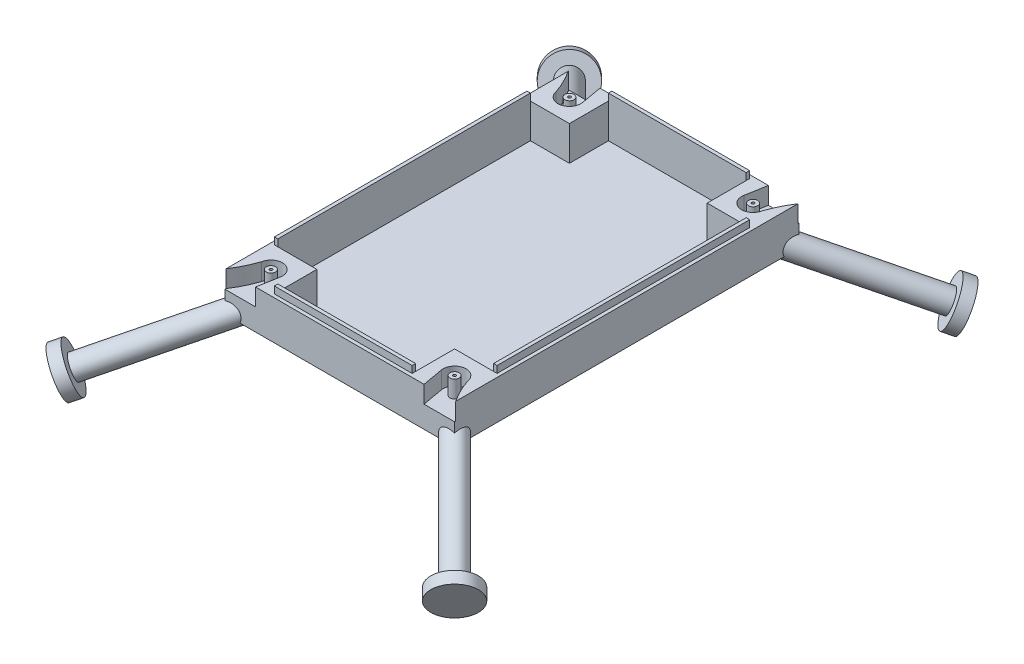
from build123d import *

# Parameters (mm, degrees)
CROQUIS1_W              = 100
CROQUIS1_H              = 150
SALIENTE_EXTRUIR1_DEPTH = 2
CROQUIS5_W              = 100
CROQUIS5_H              = 150
CROQUIS5_W_2            = 94
CROQUIS5_H_2            = 144
SALIENTE_EXTRUIR3_DEPTH = 15
CROQUIS6_W              = 20
CROQUIS6_H              = 20
SALIENTE_EXTRUIR4_DEPTH = 17
CROQUIS4_R              = 2
CORTAR_EXTRUIR2_DEPTH   = 92.378334412
SALIENTE_EXTRUIR5_DEPTH = 7.5
CROQUIS8_W              = 127.938872722
CROQUIS8_H              = 211.588515632
CROQUIS8_W_2            = 100
CROQUIS8_H_2            = 150
CORTAR_EXTRUIR3_DEPTH   = 115.867495711
CORTAR_EXTRUIR4_DEPTH   = 7.5
CROQUIS10_W             = 60
CROQUIS10_H             = 1.5
CROQUIS10_W_2           = 1.5
CROQUIS10_H_2           = 110
SALIENTE_EXTRUIR6_DEPTH = 3
CROQUIS12_R             = 0.6
CORTAR_EXTRUIR5_DEPTH   = 2
CORTAR_EXTRUIR7_DEPTH   = 157.655827733


with BuildPart() as part:
    # Croquis1 → Saliente-Extruir1 (new body)
    with BuildSketch(Plane(origin=(0, 0, 0), x_dir=(1, 0, 0), z_dir=(0, 1, 0))):
        Rectangle(CROQUIS1_W, CROQUIS1_H)
    extrude(amount=SALIENTE_EXTRUIR1_DEPTH)

    # Croquis5 → Saliente-Extruir3 (add)
    with BuildSketch(Plane(origin=(0, 2, 0), x_dir=(1, 0, 0), z_dir=(0, 1, 0))):
        Rectangle(CROQUIS5_W, CROQUIS5_H)
        Rectangle(CROQUIS5_W_2, CROQUIS5_H_2, mode=Mode.SUBTRACT)
    extrude(amount=SALIENTE_EXTRUIR3_DEPTH)

    # Croquis6 → Saliente-Extruir4 (add)
    with BuildSketch(Plane.XZ):
        with Locations((-40, 65)):
            Rectangle(CROQUIS6_W, CROQUIS6_H)
        with Locations((-40, -65)):
            Rectangle(CROQUIS6_W, CROQUIS6_H)
        with Locations((40, -65)):
            Rectangle(CROQUIS6_W, CROQUIS6_H)
        with Locations((40, 65)):
            Rectangle(CROQUIS6_W, CROQUIS6_H)
    extrude(amount=-SALIENTE_EXTRUIR4_DEPTH)

    # Croquis4 → Cortar-Extruir2 (cut, through all)
    # profile 1 of 4: a face of its own
    with BuildSketch(Plane(origin=(0, 2, 0), x_dir=(1, 0, 0), z_dir=(0, 1, 0))):
        with BuildLine():
            Line((-44.924038765, 64.131759112), (-46.660520542, 73.979836642))
            ThreePointArc((-46.660520542, 73.979836642), (-42.604722665, 79.772116295), (-36.812443012, 75.716318418))
            Line((-36.812443012, 75.716318418), (-35.075961235, 65.868240888))
            ThreePointArc((-35.075961235, 65.868240888), (-39.131759112, 60.075961235), (-44.924038765, 64.131759112))
        make_face()
        with Locations(Location((-40, 65, 0), (0, 0, 90))):
            Circle(CROQUIS4_R, mode=Mode.SUBTRACT)
    # profile 2 of 4: a face of its own
    with BuildSketch(Plane(origin=(0, 2, 0), x_dir=(1, 0, 0), z_dir=(0, 1, 0))):
        with BuildLine():
            Line((44.924038765, -64.131759112), (46.660520542, -73.979836642))
            ThreePointArc((46.660520542, -73.979836642), (42.604722665, -79.772116295), (36.812443012, -75.716318418))
            Line((36.812443012, -75.716318418), (35.075961235, -65.868240888))
            ThreePointArc((35.075961235, -65.868240888), (39.131759112, -60.075961235), (44.924038765, -64.131759112))
        make_face()
        with Locations(Location((40, -65, 0), (0, 0, 90))):
            Circle(CROQUIS4_R, mode=Mode.SUBTRACT)
    # profile 3 of 4: a face of its own
    with BuildSketch(Plane(origin=(0, 2, 0), x_dir=(1, 0, 0), z_dir=(0, 1, 0))):
        with BuildLine():
            Line((44.924038765, 64.131759112), (46.660520542, 73.979836642))
            ThreePointArc((46.660520542, 73.979836642), (42.604722665, 79.772116295), (36.812443012, 75.716318418))
            Line((36.812443012, 75.716318418), (35.075961235, 65.868240888))
            ThreePointArc((35.075961235, 65.868240888), (39.131759112, 60.075961235), (44.924038765, 64.131759112))
        make_face()
        with Locations(Location((40, 65, 0), (0, 0, 90))):
            Circle(CROQUIS4_R, mode=Mode.SUBTRACT)
    # profile 4 of 4: a face of its own
    with BuildSketch(Plane(origin=(0, 2, 0), x_dir=(1, 0, 0), z_dir=(0, 1, 0))):
        with BuildLine():
            Line((-44.924038765, -64.131759112), (-46.660520542, -73.979836642))
            ThreePointArc((-46.660520542, -73.979836642), (-42.604722665, -79.772116295), (-36.812443012, -75.716318418))
            Line((-36.812443012, -75.716318418), (-35.075961235, -65.868240888))
            ThreePointArc((-35.075961235, -65.868240888), (-39.131759112, -60.075961235), (-44.924038765, -64.131759112))
        make_face()
        with Locations(Location((-40, -65, 0), (0, 0, 90))):
            Circle(CROQUIS4_R, mode=Mode.SUBTRACT)
    extrude(amount=CORTAR_EXTRUIR2_DEPTH, mode=Mode.SUBTRACT)

    # Croquis7 → Saliente-Extruir5 (add)
    with BuildSketch(Plane(origin=(0, 2, 0), x_dir=(1, 0, 0), z_dir=(0, 1, 0))):
        with BuildLine():
            Line((35.075961235, 65.868240888), (39.187090394, 89.183612944))
            ThreePointArc((39.187090394, 89.183612944), (44.979370047, 93.239410821), (49.035167924, 87.447131167))
            Line((49.035167924, 87.447131167), (44.924038765, 64.131759112))
            ThreePointArc((44.924038765, 64.131759112), (39.131759112, 60.075961235), (35.075961235, 65.868240888))
        make_face()
        with BuildLine():
            Line((-44.924038765, 64.131759112), (-50.51627176, 95.846888427))
            ThreePointArc((-50.51627176, 95.846888427), (-46.460473883, 101.63916808), (-40.66819423, 97.583370203))
            Line((-40.66819423, 97.583370203), (-35.075961235, 65.868240888))
            ThreePointArc((-35.075961235, 65.868240888), (-39.131759112, 60.075961235), (-44.924038765, 64.131759112))
        make_face()
        with BuildLine():
            Line((-35.075961235, -65.868240888), (-36.812443012, -75.716318418))
            ThreePointArc((-36.812443012, -75.716318418), (-42.604722665, -79.772116295), (-46.660520542, -73.979836642))
            Line((-46.660520542, -73.979836642), (-44.924038765, -64.131759112))
            ThreePointArc((-44.924038765, -64.131759112), (-39.131759112, -60.075961235), (-35.075961235, -65.868240888))
        make_face()
        with BuildLine():
            Line((44.924038765, -64.131759112), (47.53565731, -78.942983887))
            ThreePointArc((47.53565731, -78.942983887), (43.479859434, -84.73526354), (37.68757978, -80.679465664))
            Line((37.68757978, -80.679465664), (35.075961235, -65.868240888))
            ThreePointArc((35.075961235, -65.868240888), (39.131759112, -60.075961235), (44.924038765, -64.131759112))
        make_face()
    extrude(amount=SALIENTE_EXTRUIR5_DEPTH)

    # Croquis8 → Cortar-Extruir3 (cut, through all)
    with BuildSketch(Plane.XZ):
        Rectangle(CROQUIS8_W, CROQUIS8_H)
        Rectangle(CROQUIS8_W_2, CROQUIS8_H_2, mode=Mode.SUBTRACT)
    extrude(amount=-CORTAR_EXTRUIR3_DEPTH, mode=Mode.SUBTRACT)

    # Croquis9 → Cortar-Extruir4 (cut)
    with BuildSketch(Plane(origin=(0, 17, 0), x_dir=(1, 0, 0), z_dir=(0, 1, 0))):
        with BuildLine():
            Line((-50, -74.5), (-50, -75))
            Line((-50, -75), (-44.511576947, -75))
            Line((-44.511576947, -75), (-44.511576947, -62.844617563))
            add(Edge.make_bspline(
                [(-50, -74.5), (-46.388295921, -69.021503378), (-44.511576947, -62.844617563)],
                knots=[0, 0, 0, 1, 1, 1], degree=2))
        make_face()
        with BuildLine():
            Line((50, -75), (44.511576947, -75))
            Line((44.511576947, -75), (44.511576947, -62.844617563))
            add(Edge.make_bspline(
                [(50, -74.5), (46.388295921, -69.021503378), (44.511576947, -62.844617563)],
                knots=[0, 0, 0, 1, 1, 1], degree=2))
            Line((50, -74.5), (50, -75))
        make_face()
        with BuildLine():
            Line((-50, 75), (-44.511576947, 75))
            Line((-44.511576947, 75), (-44.511576947, 62.844617563))
            add(Edge.make_bspline(
                [(-50, 74.5), (-46.388295921, 69.021503378), (-44.511576947, 62.844617563)],
                knots=[0, 0, 0, 1, 1, 1], degree=2))
            Line((-50, 74.5), (-50, 75))
        make_face()
        with BuildLine():
            Line((50, 75), (44.511576947, 75))
            Line((44.511576947, 75), (44.511576947, 62.844617563))
            add(Edge.make_bspline(
                [(50, 74.5), (46.388295921, 69.021503378), (44.511576947, 62.844617563)],
                knots=[0, 0, 0, 1, 1, 1], degree=2))
            Line((50, 74.5), (50, 75))
        make_face()
    extrude(amount=-CORTAR_EXTRUIR4_DEPTH, mode=Mode.SUBTRACT)

    # Croquis10 → Saliente-Extruir6 (add)
    with BuildSketch(Plane(origin=(0, 17, 0), x_dir=(1, 0, 0), z_dir=(0, 1, 0))):
        with Locations((0, 72.75)):
            Rectangle(CROQUIS10_W, CROQUIS10_H)
        with Locations((0, -72.75)):
            Rectangle(CROQUIS10_W, CROQUIS10_H)
        with Locations((-47.75, 0)):
            Rectangle(CROQUIS10_W_2, CROQUIS10_H_2)
        with Locations((47.75, 0)):
            Rectangle(CROQUIS10_W_2, CROQUIS10_H_2)
    extrude(amount=SALIENTE_EXTRUIR6_DEPTH)

    # Croquis12 → Cortar-Extruir5 (cut)
    with BuildSketch(Plane(origin=(0, 17, 0), x_dir=(1, 0, 0), z_dir=(0, 1, 0))):
        with Locations(Location((-40, -65, 0), (0, 0, 270))):
            Circle(CROQUIS12_R)
        with Locations(Location((-40, 65, 0), (0, 0, 90))):
            Circle(CROQUIS12_R)
        with Locations(Location((40, 65, 0), (0, 0, 270))):
            Circle(CROQUIS12_R)
        with Locations(Location((40, -65, 0), (0, 0, 90))):
            Circle(CROQUIS12_R)
    extrude(amount=-CORTAR_EXTRUIR5_DEPTH, mode=Mode.SUBTRACT)

    # Croquis17 → Revolución4 (revolve)
    with BuildSketch(Plane(origin=(-12.5, 0, -12.5), x_dir=(-0.7071067811865475, 0, 0.7071067811865476), z_dir=(-0.7071067811865476, 0, -0.7071067811865475)), mode=Mode.PRIVATE) as revoluci_n4_sk:
        Polygon((-74.388347648, 5.812970012), (-139.644463954, -21.860187069), (-143.51805142, -12.725874225), (-138.914857092, -10.773797899), (-136.962780767, -15.376992227), (-77.121254504, 10), align=None)
    revoluci_n4 = revolve(revoluci_n4_sk.sketch.rotate(Axis((40.100505063, 5.812970012, -65.100505063), (0.6509899848797962, -0.3904152650350718, -0.6509899848797963)), 90), axis=Axis((40.100505063, 5.812970012, -65.100505063), (0.6509899848797962, -0.3904152650350718, -0.6509899848797963)))

    # Simetría4: Revolución4 across plane
    add(revoluci_n4.mirror(Plane.XY))

    # Simetría5: Revolución4 across plane
    add(revoluci_n4.mirror(Plane(origin=(0, 0, 0), x_dir=(0, 0, 1), z_dir=(1, 0, 0))))

    # Simetría5 copy 1 sketch → Simetría5 copy 1 (revolve)
    with BuildSketch(Plane(origin=(12.5, 0, 12.5), x_dir=(0.7071067811865475, 0, -0.7071067811865476), z_dir=(0.7071067811865476, 0, 0.7071067811865475))):
        Polygon((-74.388347648, 5.812970012), (-139.644463954, -21.860187069), (-143.51805142, -12.725874225), (-138.914857092, -10.773797899), (-136.962780767, -15.376992227), (-77.121254504, 10), align=None)
    revolve(axis=Axis((-40.100505063, 5.812970012, 65.100505063), (-0.6509899848797962, -0.3904152650350718, 0.6509899848797963)))

    # Croquis19 → Cortar-Extruir7 (cut, through all)
    with BuildSketch(Plane(origin=(0, 9.5, 0), x_dir=(1, 0, 0), z_dir=(0, 1, 0))):
        Polygon((-43.417017803, -64.899000462), (-39.692445235, -68.264184449), (-41.99457515, -70.812172899), (-45.719147718, -67.446988912), align=None)
        Polygon((39.692445235, -68.264184449), (41.99457515, -70.812172899), (45.719147718, -67.446988912), (43.417017803, -64.899000462), align=None)
        Polygon((43.417017803, 64.899000462), (39.692445235, 68.264184449), (41.99457515, 70.812172899), (45.719147718, 67.446988912), align=None)
        Polygon((-39.692445235, 68.264184449), (-41.99457515, 70.812172899), (-45.719147718, 67.446988912), (-43.417017803, 64.899000462), align=None)
    extrude(amount=CORTAR_EXTRUIR7_DEPTH, mode=Mode.SUBTRACT)


solid = part.part
